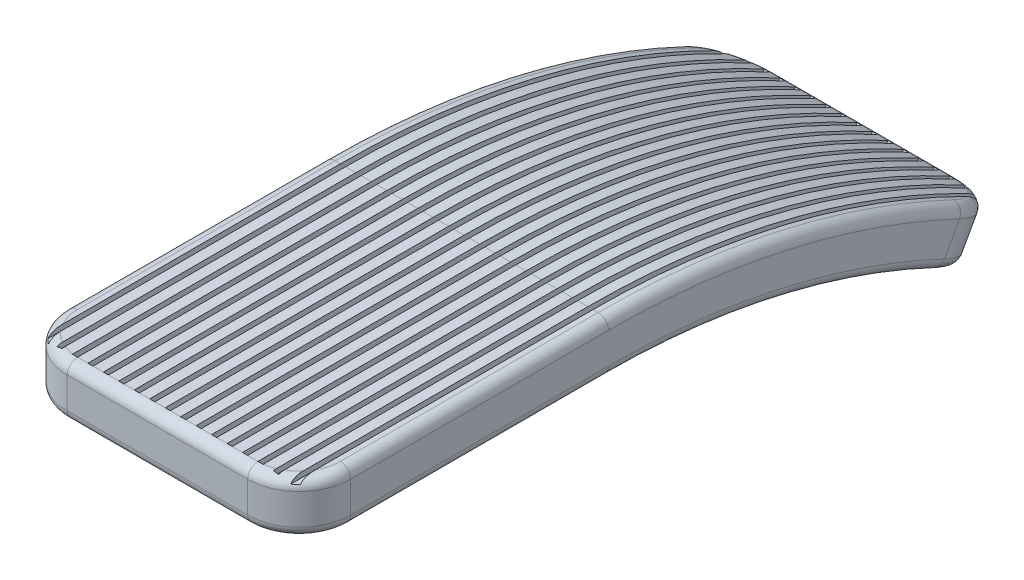
from build123d import *

# Parameters (mm, degrees)
BOSS_EXTRUDE1_DEPTH = 55
FILLET1_R           = 10
FILLET2_R           = 2
CUT_EXTRUDE1_START  = 3
CUT_EXTRUDE1_DEPTH  = 1
LPATTERN1_COUNT     = 17
LPATTERN1_PITCH     = 3


with BuildPart() as part:
    # Sketch1 → Boss-Extrude1 (new body)
    with BuildSketch(Plane(origin=(0, 0, 0), x_dir=(0, 0, -1), z_dir=(1, 0, 0))):
        with BuildLine():
            Line((0, 0), (-60, 0))
            Line((-60, 0), (-60, 10))
            Line((-60, 10), (0, 10))
            ThreePointArc((0, 10), (40.271490165, 4.881701023), (77.98230542, -10.147747315))
            Line((77.98230542, -10.147747315), (73.1383831, -18.896256706))
            ThreePointArc((73.1383831, -18.896256706), (37.77, -4.800372461), (0, 0))
        make_face()
    extrude(amount=BOSS_EXTRUDE1_DEPTH)

    # Fillet1
    fillet1_edges = [part.edges().sort_by_distance(p)[0] for p in [
        (55, 5, 60),
        (0, 5, 60),
        (55, -14.52200201, -75.56034426),
        (0, -14.52200201, -75.56034426),
    ]]
    fillet(fillet1_edges, radius=FILLET1_R)

    # Fillet2
    fillet2_edges = [part.edges().sort_by_distance(p)[0] for p in [
        (55, 10, 25),
        (27.5, -10.147747315, -77.98230542),
        (27.5, -18.896256706, -73.1383831),
        (0, 6.05778348, -35.408668488),
        (55, 6.05778348, -35.408668488),
        (52.07314973, -8.751330637, -75.405179113),
        (2.92685027, -8.751330637, -75.405179113),
        (0, 0, 25),
        (52.073435168, -17.50125288, -70.560148042),
        (2.926564832, -17.50125288, -70.560148042),
        (55, 0, 25),
        (27.5, 0, 60),
        (27.5, 10, 60),
        (52.071067812, 0, 57.071067812),
        (2.928932188, 0, 57.071067812),
        (52.071067812, 10, 57.071067812),
        (2.928932188, 10, 57.071067812),
        (55, -3.629205331, -32.905566315),
        (0, 10, 25),
        (0, -3.629205331, -32.905566315),
    ]]
    fillet(fillet2_edges, radius=FILLET2_R)

    # Sketch2 → Cut-Extrude1 (cut)
    with BuildSketch(Plane(origin=(0, 0, 0), x_dir=(0, 0, -1), z_dir=(1, 0, 0)).offset(CUT_EXTRUDE1_START)):
        with BuildLine():
            Line((-58, 10), (-58, 9))
            Line((-58, 9), (-50, 9))
            Line((-50, 9), (0, 9))
            ThreePointArc((0, 9), (35.12762731, 5.096033647), (68.540934037, -6.42534159))
            ThreePointArc((68.540934037, -6.42534159), (72.158877426, -8.196805104), (75.731074268, -10.058795186))
            Line((75.731074268, -10.058795186), (76.204423066, -9.177920101))
            ThreePointArc((76.204423066, -9.177920101), (72.609898598, -7.304291854), (68.96934165, -5.521756))
            ThreePointArc((68.96934165, -5.521756), (35.347188704, 6.071632332), (0, 10))
            Line((0, 10), (-50, 10))
            Line((-50, 10), (-58, 10))
        make_face()
    cut_extrude1 = extrude(amount=CUT_EXTRUDE1_DEPTH, mode=Mode.SUBTRACT)

    # LPattern1: Cut-Extrude1 ×17
    with Locations(*[(i * LPATTERN1_PITCH, 0, 0) for i in range(1, LPATTERN1_COUNT)]):
        add(cut_extrude1, mode=Mode.SUBTRACT)


solid = part.part
